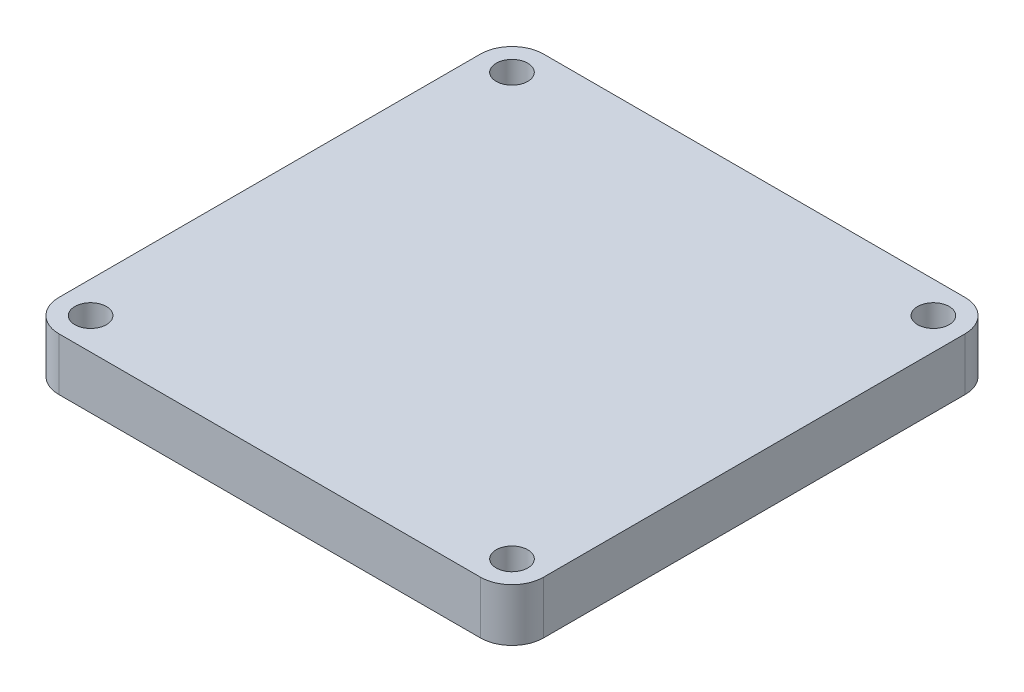
from build123d import *

# Parameters (mm, degrees)
SKETCH1_R         = 1.5
MOUNT_PLATE_DEPTH = 5


with BuildPart() as part:
    # Sketch1 → Mount_Plate (new body)
    with BuildSketch(Plane(origin=(0, 0, 0), x_dir=(1, 0, 0), z_dir=(0, 1, 0))):
        with BuildLine():
            Line((20, -23), (-20, -23))
            ThreePointArc((-20, -23), (-22.121320344, -22.121320344), (-23, -20))
            Line((-23, -20), (-23, 20))
            ThreePointArc((-23, 20), (-22.121320344, 22.121320344), (-20, 23))
            Line((-20, 23), (20, 23))
            ThreePointArc((20, 23), (22.121320344, 22.121320344), (23, 20))
            Line((23, 20), (23, -20))
            ThreePointArc((23, -20), (22.121320344, -22.121320344), (20, -23))
        make_face()
        with Locations(Location((-20, 20, 0), (0, 0, 270))):
            Circle(SKETCH1_R, mode=Mode.SUBTRACT)
        with Locations(Location((-20, -20, 0), (0, 0, 90))):
            Circle(SKETCH1_R, mode=Mode.SUBTRACT)
        with Locations(Location((20, -20, 0), (0, 0, 270))):
            Circle(SKETCH1_R, mode=Mode.SUBTRACT)
        with Locations(Location((20, 20, 0), (0, 0, 90))):
            Circle(SKETCH1_R, mode=Mode.SUBTRACT)
    extrude(amount=MOUNT_PLATE_DEPTH)


solid = part.part
